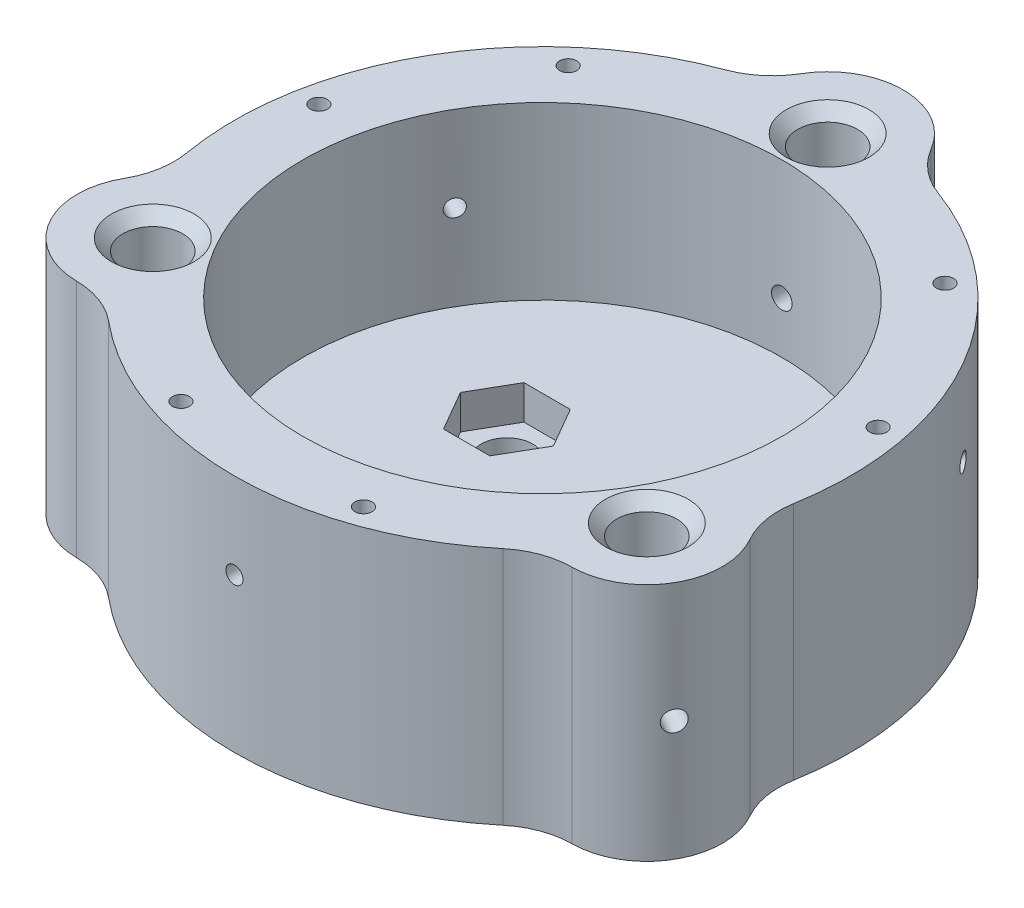
from build123d import *

# Parameters (mm, degrees)
SKETCH_1_R               = 2.625
SKETCH_1_R_2             = 21
EXTRUDE_1_DEPTH          = 15
EXTRUDE_START            = 6
EXTRUDE_2_DEPTH          = 6
FILLET_1_R               = 7
CHAMFER_1_SIZE           = 1
SKETCH_4_R               = 2.25
CUT_EXTRUDE_1_DEPTH      = 48.335527685
CUT_EXTRUDE_2_DEPTH      = 3
SKETCH_6_R               = 0.75
CUT_EXTRUDE_3_DEPTH      = 48.335527685
SKETCH_7_R               = 0.75
CUT_EXTRUDE_4_DEPTH      = 45.996135167
PATTERN_CIRCULAR_1_COUNT = 3
CUT_EXTRUDE_5_REACH      = 68.794
CUT_EXTRUDE_5_END_RADIUS = 21
SKETCH_8_R               = 0.9
PATTERN_CIRCULAR_2_COUNT = 3


with BuildPart() as part:
    # Эскиз1 → Бобышка-Вытянуть1 (new body)
    with BuildSketch(Plane(origin=(0, 0, 0), x_dir=(1, 0, 0), z_dir=(0, 1, 0))):
        with BuildLine():
            ThreePointArc((25.949265582, -7.458928593), (23.382685902, 13.5), (6.515011145, 26.2021875))
            ThreePointArc((6.515011145, 26.2021875), (0, 31.625), (-6.515011145, 26.2021875))
            ThreePointArc((-6.515011145, 26.2021875), (-23.382685902, 13.5), (-25.949265582, -7.458928593))
            ThreePointArc((-25.949265582, -7.458928593), (-27.388053395, -15.8125), (-19.434254437, -18.743258907))
            ThreePointArc((-19.434254437, -18.743258907), (0, -27), (19.434254437, -18.743258907))
            ThreePointArc((19.434254437, -18.743258907), (27.388053395, -15.8125), (25.949265582, -7.458928593))
        make_face()
        with Locations(Location((0, 25, 0), (0, 0, 270))):
            Circle(SKETCH_1_R, mode=Mode.SUBTRACT)
        with Locations(Location((0, 0, 0), (0, 0, 270))):
            Circle(SKETCH_1_R_2, mode=Mode.SUBTRACT)
        with Locations(Location((-21.650635095, -12.5, 0), (0, 0, 270))):
            Circle(SKETCH_1_R, mode=Mode.SUBTRACT)
        with Locations(Location((21.650635095, -12.5, 0), (0, 0, 270))):
            Circle(SKETCH_1_R, mode=Mode.SUBTRACT)
    extrude(amount=EXTRUDE_1_DEPTH)

    # Эскиз2 → Бобышка-Вытянуть2 (add)
    with BuildSketch(Plane.XZ.offset(EXTRUDE_START)):
        with BuildLine():
            ThreePointArc((25.949265582, 7.458928593), (27.388053395, 15.8125), (19.434254437, 18.743258907))
            ThreePointArc((19.434254437, 18.743258907), (0, 27), (-19.434254437, 18.743258907))
            ThreePointArc((-19.434254437, 18.743258907), (-27.388053395, 15.8125), (-25.949265582, 7.458928593))
            ThreePointArc((-25.949265582, 7.458928593), (-23.382685902, -13.5), (-6.515011145, -26.2021875))
            ThreePointArc((-6.515011145, -26.2021875), (0, -31.625), (6.515011145, -26.2021875))
            ThreePointArc((6.515011145, -26.2021875), (23.382685902, -13.5), (25.949265582, 7.458928593))
        make_face()
    extrude(amount=-EXTRUDE_2_DEPTH)

    # Скругление1
    fillet_1_edges = [part.edges().sort_by_distance(p)[0] for p in [
        (19.434254437, 4.5, 18.743258907),
        (-19.434254437, 4.5, 18.743258907),
        (-25.949265582, 4.5, 7.458928593),
        (-6.515011145, 4.5, -26.2021875),
        (6.515011145, 4.5, -26.2021875),
        (25.949265582, 4.5, 7.458928593),
    ]]
    fillet(fillet_1_edges, radius=FILLET_1_R)

    # Фаска1
    chamfer_1_edges = [part.edges().sort_by_distance(p)[0] for p in [
        (21.650635095, 15, 9.875),
        (0, 15, -27.625),
        (-21.650635095, 15, 9.875),
    ]]
    chamfer(chamfer_1_edges, length=CHAMFER_1_SIZE)

    # Эскиз4 → Вырез-Вытянуть1 (cut, through all)
    with BuildSketch(Plane.XZ.offset(6)):
        with Locations(Location((0, 8.5, 0), (0, 0, 270))):
            Circle(SKETCH_4_R)
        with Locations(Location((7.361215932, -4.25, 0), (0, 0, 270))):
            Circle(SKETCH_4_R)
        with Locations(Location((-7.361215932, -4.25, 0), (0, 0, 270))):
            Circle(SKETCH_4_R)
    extrude(amount=-CUT_EXTRUDE_1_DEPTH, mode=Mode.SUBTRACT)

    # Эскиз5 → Вырез-Вытянуть2 (cut)
    with BuildSketch(Plane(origin=(0, 0, 0), x_dir=(1, 0, 0), z_dir=(0, 1, 0))):
        Polygon((2.035159699, -12.025), (4.070319398, -8.5), (2.035159699, -4.975), (-2.035159699, -4.975), (-4.070319398, -8.5), (-2.035159699, -12.025), align=None)
        Polygon((5.326056233, 0.725), (9.396375631, 0.725), (11.43153533, 4.25), (9.396375631, 7.775), (5.326056233, 7.775), (3.290896534, 4.25), align=None)
        Polygon((-11.43153533, 4.25), (-9.396375631, 0.725), (-5.326056233, 0.725), (-3.290896534, 4.25), (-5.326056233, 7.775), (-9.396375631, 7.775), align=None)
    extrude(amount=-CUT_EXTRUDE_2_DEPTH, mode=Mode.SUBTRACT)

    # Эскиз6 → Вырез-Вытянуть3 (cut, through all)
    with BuildSketch(Plane(origin=(0, 15, 0), x_dir=(1, 0, 0), z_dir=(0, 1, 0))):
        with Locations(Location((-8, -23.685438565, 0), (0, 0, 270))):
            Circle(SKETCH_6_R)
        with Locations(Location((8, -23.685438565, 0), (0, 0, 270))):
            Circle(SKETCH_6_R)
        with Locations(Location((-16.512191497, 18.770922513, 0), (0, 0, 270))):
            Circle(SKETCH_6_R)
        with Locations(Location((-24.512191497, 4.914516052, 0), (0, 0, 270))):
            Circle(SKETCH_6_R)
        with Locations(Location((24.512191497, 4.914516052, 0), (0, 0, 270))):
            Circle(SKETCH_6_R)
        with Locations(Location((16.512191497, 18.770922513, 0), (0, 0, 270))):
            Circle(SKETCH_6_R)
    extrude(amount=-CUT_EXTRUDE_3_DEPTH, mode=Mode.SUBTRACT)

    # Эскиз7 → Вырез-Вытянуть4 (cut, through all)
    with BuildSketch(Plane.XY):
        with Locations(Location((0, 7.5, 0), (0, 0, 270.000000034))):
            Circle(SKETCH_7_R)
    cut_extrude_4 = extrude(amount=CUT_EXTRUDE_4_DEPTH, mode=Mode.SUBTRACT)

    # Круговой массив1: Вырез-Вытянуть4 ×3 about axis
    pattern_circular_1_axis = Axis((0, 15, 0), (0, -1, 0))
    for i in range(1, PATTERN_CIRCULAR_1_COUNT):
        add(cut_extrude_4.rotate(pattern_circular_1_axis, i * 360 / PATTERN_CIRCULAR_1_COUNT), mode=Mode.SUBTRACT)

    # Вырез-Вытянуть5: up to this cylinder (the profile starts outside it)
    cut_extrude_5_end = Plane(origin=(0, 4.5, 0), z_dir=(0, -1, 0)) * Cylinder(CUT_EXTRUDE_5_END_RADIUS, 180.588, mode=Mode.PRIVATE)
    # Эскиз8 → Вырез-Вытянуть5 (cut, up to the surface)
    with BuildSketch(Plane(origin=(0, 0, -31.625), x_dir=(-1, 0, 0), z_dir=(0, 0, -1)), mode=Mode.PRIVATE) as cut_extrude_5_sk1:
        with Locations((0, 4.5)):
            Circle(SKETCH_8_R)
    cut_extrude_5_tool1 = extrude(cut_extrude_5_sk1.sketch, amount=-CUT_EXTRUDE_5_REACH, mode=Mode.PRIVATE) - cut_extrude_5_end
    cut_extrude_5 = cut_extrude_5_tool1.solids().sort_by_distance((0, 4.5, -31.625))[0]
    add(cut_extrude_5, mode=Mode.SUBTRACT)

    # Круговой массив2: Вырез-Вытянуть5 ×3 about axis
    pattern_circular_2_axis = Axis((0, 15, 0), (0, -1, 0))
    for i in range(1, PATTERN_CIRCULAR_2_COUNT):
        add(cut_extrude_5.rotate(pattern_circular_2_axis, i * 360 / PATTERN_CIRCULAR_2_COUNT), mode=Mode.SUBTRACT)


solid = part.part
